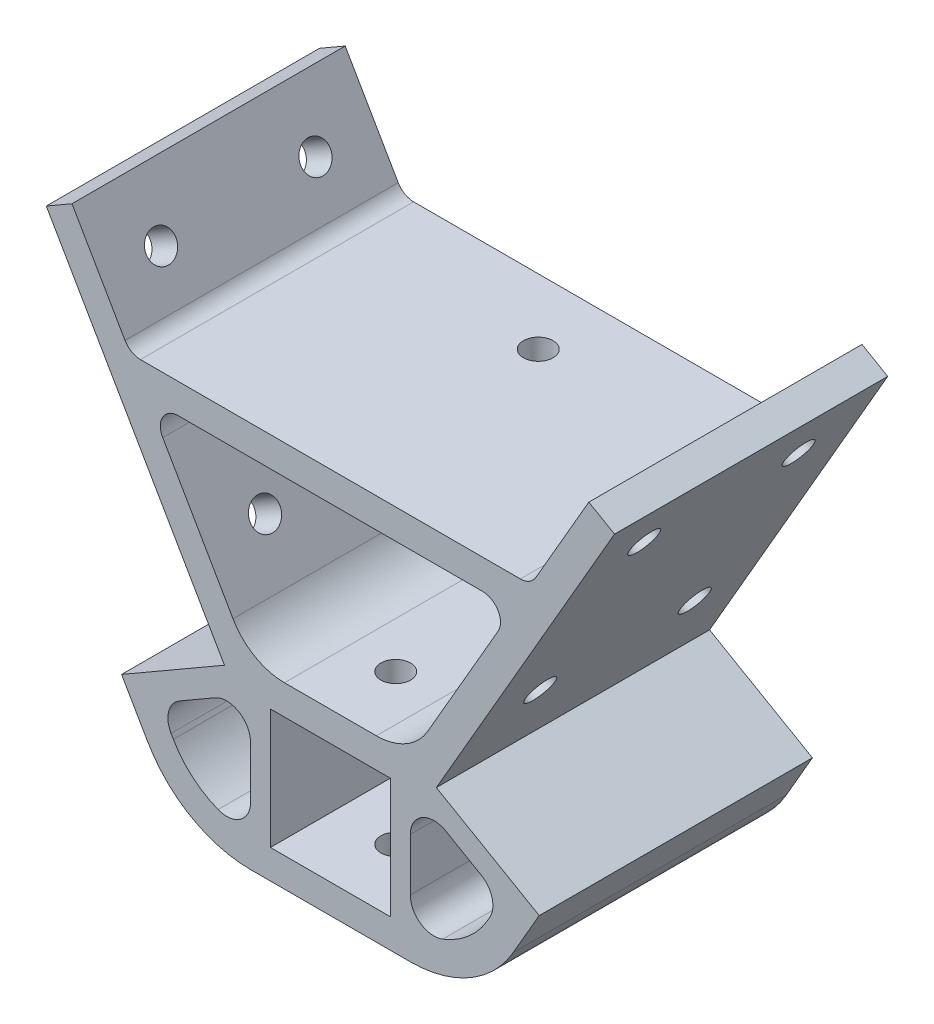
from build123d import *

# Parameters (mm, degrees)
SCHIZZO1_W                   = 20.2
SCHIZZO1_H                   = 20.2
ESTRUSIONE_ESTRUSIONE1_DEPTH = 46
RACCORDO1_R                  = 20
SCHIZZO8_R                   = 2.5
TAGLIO_ESTRUSIONE3_DEPTH     = 5
TAGLIO_ESTRUSIONE4_DEPTH     = 106.540709324
RACCORDO2_R                  = 10
RACCORDO3_R                  = 4
SCHIZZO11_R                  = 2.5
TAGLIO_ESTRUSIONE5_DEPTH     = 106.540709324
ESTRUSIONE_ESTRUSIONE2_DEPTH = 46
RACCORDO4_R                  = 3
SCHIZZO11_3_R                = 2.5
TAGLIO_ESTRUSIONE6_DEPTH     = 106.540709324


with BuildPart() as part:
    # Schizzo1 → Estrusione-Estrusione1 (new body)
    with BuildSketch(Plane.XY):
        Polygon((25, 0), (-25, 0), (-35.161364738, 17.6), (-17.840856662, 27.6), (-47.840856662, 79.561524227), (-43.510729643, 82.061524227), (-13.510729643, 30.1), (13.510729643, 30.1), (43.510729643, 82.061524227), (47.840856662, 79.561524227), (17.840856662, 27.6), (35.161364738, 17.6), align=None)
        with Locations((0, 15)):
            Rectangle(SCHIZZO1_W, SCHIZZO1_H, mode=Mode.SUBTRACT)
    extrude(amount=ESTRUSIONE_ESTRUSIONE1_DEPTH)

    # Raccordo1
    raccordo1_edges = [part.edges().sort_by_distance(p)[0] for p in [
        (25, 0, 23),
        (-25, 0, 23),
    ]]
    fillet(raccordo1_edges, radius=RACCORDO1_R)

    # Schizzo8 → Taglio-Estrusione3 (cut)
    with BuildSketch(Plane(origin=(-1.429491924, -0.825317547, 0), x_dir=(0, 0, 1), z_dir=(-0.8660254037844398, -0.49999999999999806, 0))):
        with Locations(Location((10, 82.822729475, 0), (0, 0, 270))):
            Circle(SCHIZZO8_R)
        with Locations(Location((10, 47.822729475, 0), (0, 0, 270))):
            Circle(SCHIZZO8_R)
        with Locations(Location((36, 47.822729475, 0), (0, 0, 90))):
            Circle(SCHIZZO8_R)
        with Locations(Location((36, 82.822729475, 0), (0, 0, 270))):
            Circle(SCHIZZO8_R)
    taglio_estrusione3 = extrude(amount=-TAGLIO_ESTRUSIONE3_DEPTH, mode=Mode.SUBTRACT)

    # Specchia1: Taglio-Estrusione3 across plane
    add(taglio_estrusione3.mirror(Plane(origin=(0, 0, 0), x_dir=(0, 0, 1), z_dir=(1, 0, 0))), mode=Mode.SUBTRACT)

    # Schizzo10 → Taglio-Estrusione4 (cut, through all)
    with BuildSketch(Plane(origin=(0, 0, 0), x_dir=(-1, 0, 0), z_dir=(0, 0, -1))):
        with BuildLine():
            Line((-28.831237719, 16.635898385), (-13.452994616, 25.51453118))
            Line((-13.452994616, 25.51453118), (-13.452994616, 5))
            ThreePointArc((-13.452994616, 5), (-20.952994616, 7.009618943), (-26.443375673, 12.5))
            Line((-26.443375673, 12.5), (-28.831237719, 16.635898385))
        make_face()
        with BuildLine():
            Line((13.452994616, 25.51453118), (13.452994616, 5))
            ThreePointArc((13.452994616, 5), (20.952994616, 7.009618943), (26.443375673, 12.5))
            Line((26.443375673, 12.5), (28.831237719, 16.635898385))
            Line((28.831237719, 16.635898385), (13.452994616, 25.51453118))
        make_face()
    extrude(amount=-TAGLIO_ESTRUSIONE4_DEPTH, mode=Mode.SUBTRACT)

    # Raccordo2
    raccordo2_edges = [part.edges().sort_by_distance(p)[0] for p in [
        (-13.510729643, 30.1, 23),
        (13.510729643, 30.1, 23),
    ]]
    fillet(raccordo2_edges, radius=RACCORDO2_R)

    # Raccordo3
    raccordo3_edges = [part.edges().sort_by_distance(p)[0] for p in [
        (28.831237719, 16.635898385, 23),
        (13.452994616, 25.51453118, 23),
        (13.452994616, 5, 23),
        (-13.452994616, 5, 23),
        (-13.452994616, 25.51453118, 23),
        (-28.831237719, 16.635898385, 23),
    ]]
    fillet(raccordo3_edges, radius=RACCORDO3_R)

    # Schizzo11 → Taglio-Estrusione5 (cut, through all)
    with BuildSketch(Plane.XZ):
        with Locations((0, 35)):
            Circle(SCHIZZO11_R)
        with Locations((0, 11)):
            Circle(SCHIZZO11_R)
    extrude(amount=-TAGLIO_ESTRUSIONE5_DEPTH, mode=Mode.SUBTRACT)

    # Schizzo13 → Estrusione-Estrusione2 (add)
    with BuildSketch(Plane(origin=(0, 0, 0), x_dir=(-1, 0, 0), z_dir=(0, 0, -1))):
        Polygon((-33.717989065, 65.1), (33.717989065, 65.1), (30.831237719, 60.1), (-30.831237719, 60.1), align=None)
    extrude(amount=-ESTRUSIONE_ESTRUSIONE2_DEPTH)

    # Raccordo4
    raccordo4_edges = [part.edges().sort_by_distance(p)[0] for p in [
        (30.831237719, 60.1, 23),
        (33.717989065, 65.1, 23),
        (-33.717989065, 65.1, 23),
        (-30.831237719, 60.1, 23),
    ]]
    fillet(raccordo4_edges, radius=RACCORDO4_R)

    # Schizzo11<3> → Taglio-Estrusione6 (cut, through all)
    with BuildSketch(Plane.XZ):
        with Locations((0, 11)):
            Circle(SCHIZZO11_3_R)
    extrude(amount=-TAGLIO_ESTRUSIONE6_DEPTH, mode=Mode.SUBTRACT)


solid = part.part
